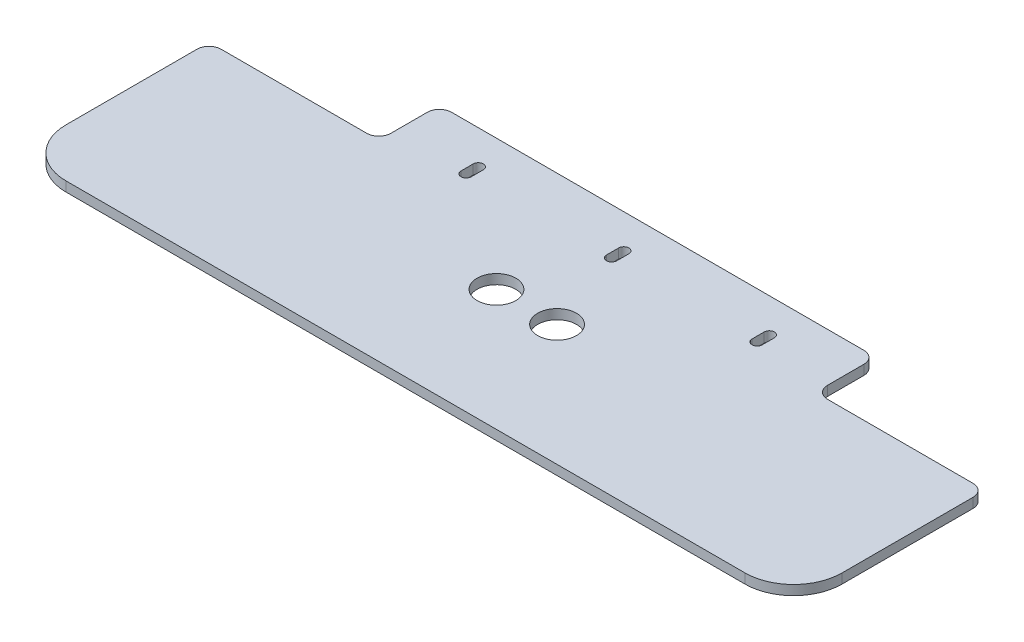
from build123d import *

# Parameters (mm, degrees)
EXTRUDE_1_DEPTH     = 4
FILLET_1_R          = 5
FILLET_2_R          = 20
FILLET_3_R          = 5
SKETCH_2_R          = 8
CUT_EXTRUDE_1_DEPTH = 10
CUT_EXTRUDE_2_DEPTH = 10


with BuildPart() as part:
    # 草图1 → 凸台-拉伸1 (new body)
    with BuildSketch(Plane(origin=(0, 0, 0), x_dir=(1, 0, 0), z_dir=(0, 1, 0))):
        Polygon((90, 54), (90, 29), (160, 29), (160, -50), (-160, -50), (-160, 29), (-90, 29), (-90, 54), align=None)
    extrude(amount=EXTRUDE_1_DEPTH)

    # 圆角1
    fillet_1_edges = [part.edges().sort_by_distance(p)[0] for p in [
        (-90, 2, -29),
        (-90, 2, -54),
        (90, 2, -54),
        (90, 2, -29),
    ]]
    fillet(fillet_1_edges, radius=FILLET_1_R)

    # 圆角2
    fillet_2_edges = [part.edges().sort_by_distance(p)[0] for p in [
        (160, 2, 50),
        (-160, 2, 50),
    ]]
    fillet(fillet_2_edges, radius=FILLET_2_R)

    # 圆角3
    fillet_3_edges = [part.edges().sort_by_distance(p)[0] for p in [
        (-160, 2, -29),
        (160, 2, -29),
    ]]
    fillet(fillet_3_edges, radius=FILLET_3_R)

    # 草图2 → 切除-拉伸1 (cut)
    with BuildSketch(Plane.XZ):
        with Locations(Location((12.499997526, 0.007864027, 0), (0, 0, 270))):
            Circle(SKETCH_2_R)
        with Locations(Location((-12.499997526, -0.007864027, 0), (0, 0, 270))):
            Circle(SKETCH_2_R)
    extrude(amount=-CUT_EXTRUDE_1_DEPTH, mode=Mode.SUBTRACT)

    # 草图4 → 切除-拉伸2 (cut)
    with BuildSketch(Plane(origin=(0, 4, 0), x_dir=(1, 0, 0), z_dir=(0, 1, 0))):
        with BuildLine():
            Line((-2.1, 35), (-2.1, 40))
            ThreePointArc((-2.1, 40), (0, 42.1), (2.1, 40))
            Line((2.1, 40), (2.1, 35))
            ThreePointArc((2.1, 35), (0, 32.9), (-2.1, 35))
        make_face()
        with BuildLine():
            Line((62.1, 35), (62.1, 40))
            ThreePointArc((62.1, 40), (60, 42.1), (57.9, 40))
            Line((57.9, 40), (57.9, 35))
            ThreePointArc((57.9, 35), (60, 32.9), (62.1, 35))
        make_face()
        with BuildLine():
            Line((-57.9, 35), (-57.9, 40))
            ThreePointArc((-57.9, 40), (-60, 42.1), (-62.1, 40))
            Line((-62.1, 40), (-62.1, 35))
            ThreePointArc((-62.1, 35), (-60, 32.9), (-57.9, 35))
        make_face()
    extrude(amount=-CUT_EXTRUDE_2_DEPTH, mode=Mode.SUBTRACT)


solid = part.part
